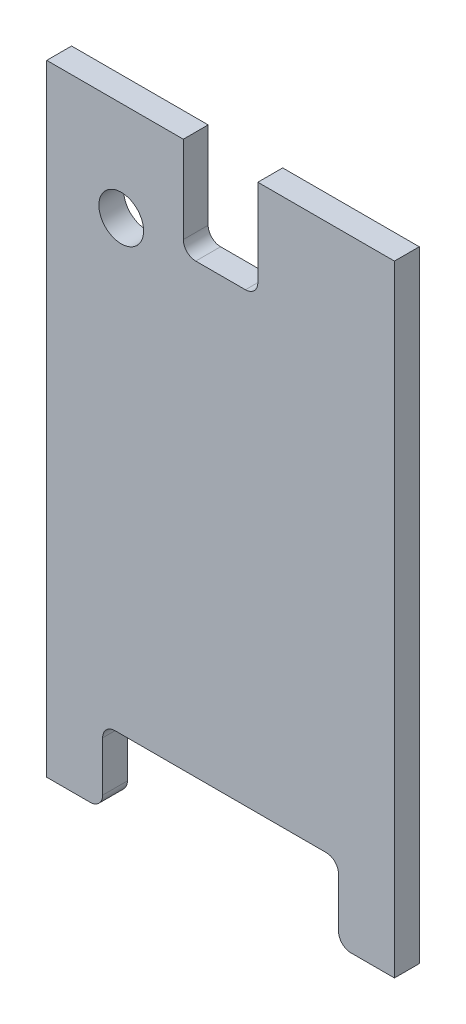
from build123d import *

# Parameters (mm, degrees)
SKETCH1_R           = 11.43
BOSS_EXTRUDE2_DEPTH = 12.7


with BuildPart() as part:
    # Sketch1 → Boss-Extrude2 (new body)
    with BuildSketch(Plane.XY):
        with BuildLine():
            Line((103.972822377, 346.773604775), (173.822822377, 346.773604775))
            Line((173.822822377, 346.773604775), (173.822822377, 35.623604775))
            Line((173.822822377, 35.623604775), (173.822822377, 29.273604775))
            Line((173.822822377, 29.273604775), (161.122822377, 29.273604775))
            Line((161.122822377, 29.273604775), (151.597822377, 29.273604775))
            ThreePointArc((151.597822377, 29.273604775), (147.107694316, 31.133476714), (145.247822377, 35.623604775))
            Line((145.247822377, 35.623604775), (145.247822377, 61.023604775))
            ThreePointArc((145.247822377, 61.023604775), (143.387950437, 65.513732836), (138.897822377, 67.373604775))
            Line((138.897822377, 67.373604775), (30.947822377, 67.373604775))
            ThreePointArc((30.947822377, 67.373604775), (26.457694316, 65.513732836), (24.597822377, 61.023604775))
            Line((24.597822377, 61.023604775), (24.597822377, 35.623604775))
            ThreePointArc((24.597822377, 35.623604775), (22.737950437, 31.133476714), (18.247822377, 29.273604775))
            Line((18.247822377, 29.273604775), (2.372822377, 29.273604775))
            Line((2.372822377, 29.273604775), (-3.977177623, 29.273604775))
            Line((-3.977177623, 29.273604775), (-3.977177623, 35.623604775))
            Line((-3.977177623, 35.623604775), (-3.977177623, 346.773604775))
            Line((-3.977177623, 346.773604775), (65.872822377, 346.773604775))
            Line((65.872822377, 346.773604775), (65.872822377, 302.323604775))
            ThreePointArc((65.872822377, 302.323604775), (67.732694316, 297.833476714), (72.222822377, 295.973604775))
            Line((72.222822377, 295.973604775), (97.622822377, 295.973604775))
            ThreePointArc((97.622822377, 295.973604775), (102.112950437, 297.833476714), (103.972822377, 302.323604775))
            Line((103.972822377, 302.323604775), (103.972822377, 346.773604775))
        make_face()
        with Locations((34.122822377, 295.973604775)):
            Circle(SKETCH1_R, mode=Mode.SUBTRACT)
    extrude(amount=BOSS_EXTRUDE2_DEPTH)


solid = part.part
